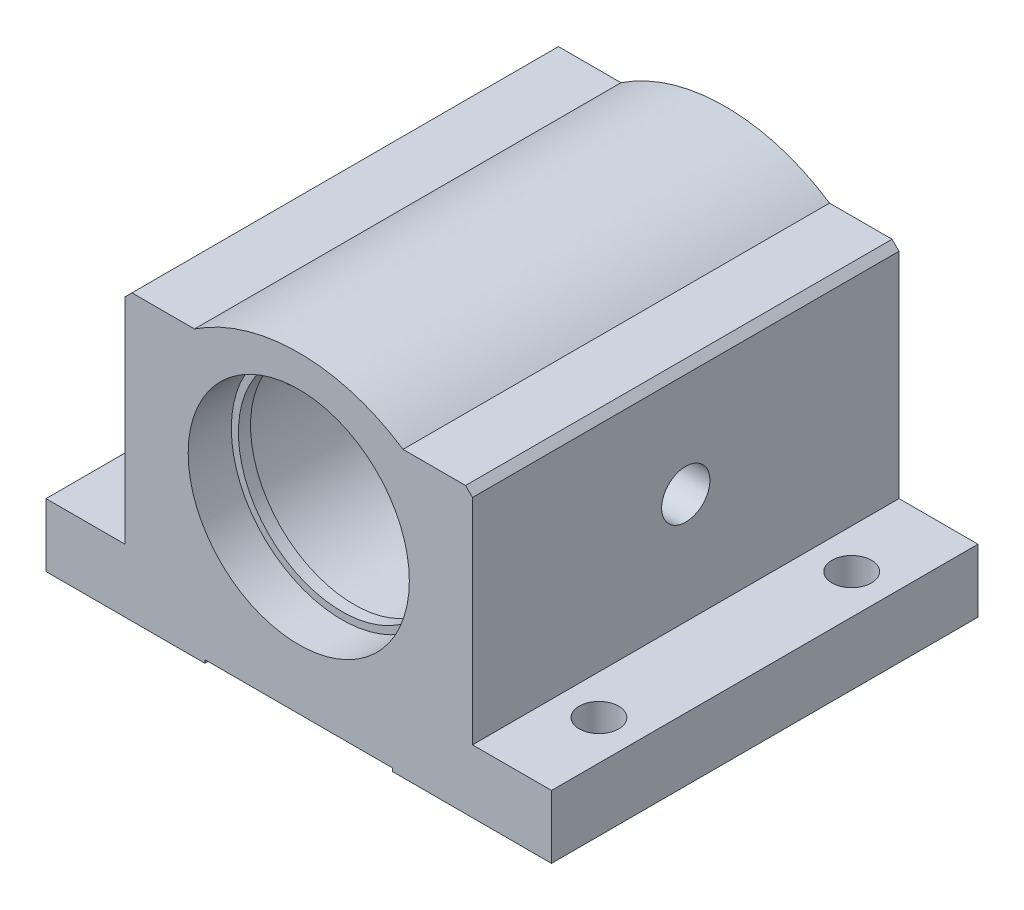
from build123d import *

# Parameters (mm, degrees)
BOSS_EXTRUDE1_START     = -21.43125
SKETCH4_R               = 11.1125
BOSS_EXTRUDE1_DEPTH     = 42.8625
SKETCH5_R               = 1.984375
CUT_EXTRUDE1_DEPTH      = 42.828441001
CHAMFER1_SIZE           = 0.6985
SKETCH6_R               = 11.8237
CUT_EXTRUDE2_DEPTH      = 1.2192
CUT_EXTRUDE3_REACH      = 52.483
CUT_EXTRUDE3_END_RADIUS = 11.1125
SKETCH7_R               = 2.4257
SKETCH8_R               = 0.638420992
BOSS_EXTRUDE2_DEPTH     = 1.2192


with BuildPart() as part:
    # Sketch4 → Boss-Extrude1 (new body)
    with BuildSketch(Plane.XY.offset(BOSS_EXTRUDE1_START)):
        with BuildLine():
            Line((-25.4, -9.525), (-17.4625, -9.525))
            Line((-17.4625, -9.525), (-17.4625, 12.7))
            Line((-17.4625, 12.7), (-10.4775, 12.7))
            ThreePointArc((-10.4775, 12.7), (0, 15.875), (10.4775, 12.7))
            Line((10.4775, 12.7), (17.4625, 12.7))
            Line((17.4625, 12.7), (17.4625, -9.525))
            Line((17.4625, -9.525), (25.4, -9.525))
            Line((25.4, -9.525), (25.4, -15.875))
            Line((25.4, -15.875), (9.42975, -15.875))
            Line((9.42975, -15.875), (9.42975, -15.5575))
            Line((9.42975, -15.5575), (-9.42975, -15.5575))
            Line((-9.42975, -15.5575), (-9.42975, -15.875))
            Line((-9.42975, -15.875), (-25.4, -15.875))
            Line((-25.4, -15.875), (-25.4, -9.525))
        make_face()
        with Locations((0, 1.5748)):
            Circle(SKETCH4_R, mode=Mode.SUBTRACT)
    extrude(amount=BOSS_EXTRUDE1_DEPTH)

    # Sketch5 → Cut-Extrude1 (cut, through all)
    with BuildSketch(Plane(origin=(0, -9.525, 0), x_dir=(1, 0, 0), z_dir=(0, 1, 0))):
        with Locations(Location((-21.4376, 12.7, 0), (0, 0, 180))):
            Circle(SKETCH5_R)
        with Locations(Location((21.4376, 12.7, 0), (0, 0, 180))):
            Circle(SKETCH5_R)
        with Locations(Location((21.4376, -12.7, 0), (0, 0, 180))):
            Circle(SKETCH5_R)
        with Locations(Location((-21.4376, -12.7, 0), (0, 0, 180))):
            Circle(SKETCH5_R)
    extrude(amount=-CUT_EXTRUDE1_DEPTH, mode=Mode.SUBTRACT)

    # Chamfer1
    chamfer1_edges = [part.edges().sort_by_distance(p)[0] for p in [
        (-17.4625, 12.7, 0),
        (17.4625, 12.7, 0),
    ]]
    chamfer(chamfer1_edges, length=CHAMFER1_SIZE)

    # Sketch6 → Cut-Extrude2 (cut)
    with BuildSketch(Plane.XY.offset(15.875)):
        with Locations((0, 1.5748)):
            Circle(SKETCH6_R)
    cut_extrude2 = extrude(amount=CUT_EXTRUDE2_DEPTH, mode=Mode.SUBTRACT)

    # Mirror1: Cut-Extrude2 across plane
    add(cut_extrude2.mirror(Plane.XY), mode=Mode.SUBTRACT)

    # Cut-Extrude3: up to this cylinder (the profile starts outside it)
    cut_extrude3_end = Plane(origin=(0, 1.5748, 0), z_dir=(0, 0, -1)) * Cylinder(CUT_EXTRUDE3_END_RADIUS, 128.191, mode=Mode.PRIVATE)
    # Sketch7 → Cut-Extrude3 (cut, up to the surface)
    with BuildSketch(Plane(origin=(17.4625, 0, 0), x_dir=(0, 0, -1), z_dir=(1, 0, 0)), mode=Mode.PRIVATE) as cut_extrude3_sk1:
        with Locations((0, 1.5748)):
            Circle(SKETCH7_R)
    cut_extrude3_tool1 = extrude(cut_extrude3_sk1.sketch, amount=-CUT_EXTRUDE3_REACH, mode=Mode.PRIVATE) - cut_extrude3_end
    add(cut_extrude3_tool1.solids().sort_by_distance((17.4625, 1.5748, 0))[0], mode=Mode.SUBTRACT)


with BuildPart() as body_2:
    # Sketch8 → Boss-Extrude2 (new body)
    with BuildSketch(Plane.XY.offset(15.875)):
        with BuildLine():
            Line((-4.358174036, 9.949170903), (-5.178855249, 12.203974004))
            ThreePointArc((-5.178855249, 12.203974004), (-6.864103953, 11.202050834), (-8.360618449, 9.935418449))
            ThreePointArc((-8.360618449, 9.935418449), (0, -10.2489), (8.360618449, 9.935418449))
            ThreePointArc((8.360618449, 9.935418449), (6.864103953, 11.202050834), (5.178855249, 12.203974004))
            Line((5.178855249, 12.203974004), (4.358174036, 9.949170903))
            ThreePointArc((4.358174036, 9.949170903), (4.825646551, 8.466537503), (6.378751233, 8.534347518))
            Line((6.378751233, 8.534347518), (6.874807318, 8.950587996))
            ThreePointArc((6.874807318, 8.950587996), (7.118893646, 9.033444139), (7.354829763, 8.929629763))
            ThreePointArc((7.354829763, 8.929629763), (0, -8.8265), (-7.354829763, 8.929629763))
            ThreePointArc((-7.354829763, 8.929629763), (-7.118893646, 9.033444139), (-6.874807318, 8.950587996))
            Line((-6.874807318, 8.950587996), (-6.378751233, 8.534347518))
            ThreePointArc((-6.378751233, 8.534347518), (-4.825646551, 8.466537503), (-4.358174036, 9.949170903))
        make_face()
        with Locations((-5.558013026, 9.512465224)):
            Circle(SKETCH8_R, mode=Mode.SUBTRACT)
        with Locations(Location((5.558013026, 9.512465224, 0), (0, 0, 180))):
            Circle(SKETCH8_R, mode=Mode.SUBTRACT)
    extrude(amount=BOSS_EXTRUDE2_DEPTH)


with BuildPart() as body_3:
    # Mirror2: mirrored copy
    add(body_2.part.mirror(Plane.XY))


solid = Compound([part.part, body_2.part, body_3.part])
